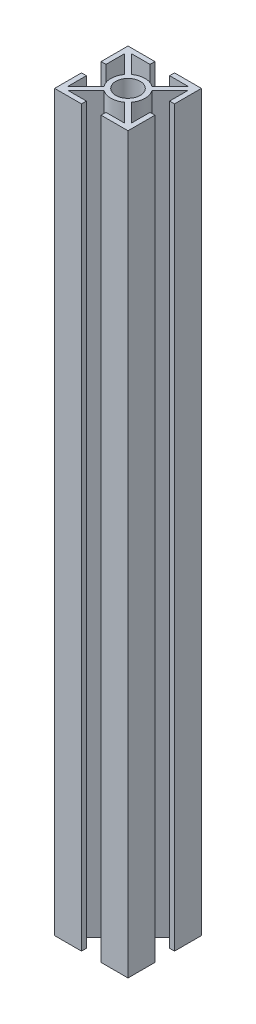
from build123d import *

# Parameters (mm, degrees)
SKETCH1_R           = 5
BOSS_EXTRUDE1_DEPTH = 300


with BuildPart() as part:
    # Sketch1 → Boss-Extrude1 (new body)
    with BuildSketch(Plane(origin=(0, 0, 0), x_dir=(1, 0, 0), z_dir=(0, 1, 0))):
        with BuildLine():
            Line((4.191872704, 5.606086267), (11.5870568, 13.001270363))
            Line((11.5870568, 13.001270363), (4.001270363, 13.001270363))
            Line((4.001270363, 13.001270363), (4.001270363, 15.001270363))
            Line((4.001270363, 15.001270363), (15.001270363, 15.001270363))
            Line((15.001270363, 15.001270363), (15.001270363, 4.001270363))
            Line((15.001270363, 4.001270363), (13.001270363, 4.001270363))
            Line((13.001270363, 4.001270363), (13.001270363, 11.5870568))
            Line((13.001270363, 11.5870568), (5.606086267, 4.191872704))
            ThreePointArc((5.606086267, 4.191872704), (7, 0), (5.606086267, -4.191872704))
            Line((5.606086267, -4.191872704), (13.001270363, -11.5870568))
            Line((13.001270363, -11.5870568), (13.001270363, -4.001270363))
            Line((13.001270363, -4.001270363), (15.001270363, -4.001270363))
            Line((15.001270363, -4.001270363), (15.001270363, -15.001270363))
            Line((15.001270363, -15.001270363), (4.001270363, -15.001270363))
            Line((4.001270363, -15.001270363), (4.001270363, -13.001270363))
            Line((4.001270363, -13.001270363), (11.5870568, -13.001270363))
            Line((11.5870568, -13.001270363), (4.191872704, -5.606086267))
            ThreePointArc((4.191872704, -5.606086267), (0, -7), (-4.191872704, -5.606086267))
            Line((-4.191872704, -5.606086267), (-11.5870568, -13.001270363))
            Line((-11.5870568, -13.001270363), (-4.001270363, -13.001270363))
            Line((-4.001270363, -13.001270363), (-4.001270363, -15.001270363))
            Line((-4.001270363, -15.001270363), (-15.001270363, -15.001270363))
            Line((-15.001270363, -15.001270363), (-15.001270363, -4.001270363))
            Line((-15.001270363, -4.001270363), (-13.001270363, -4.001270363))
            Line((-13.001270363, -4.001270363), (-13.001270363, -11.5870568))
            Line((-13.001270363, -11.5870568), (-5.606086267, -4.191872704))
            ThreePointArc((-5.606086267, -4.191872704), (-7, 0), (-5.606086267, 4.191872704))
            Line((-5.606086267, 4.191872704), (-13.001270363, 11.5870568))
            Line((-13.001270363, 11.5870568), (-13.001270363, 4.001270363))
            Line((-13.001270363, 4.001270363), (-15.001270363, 4.001270363))
            Line((-15.001270363, 4.001270363), (-15.001270363, 15.001270363))
            Line((-15.001270363, 15.001270363), (-4.001270363, 15.001270363))
            Line((-4.001270363, 15.001270363), (-4.001270363, 13.001270363))
            Line((-4.001270363, 13.001270363), (-11.5870568, 13.001270363))
            Line((-11.5870568, 13.001270363), (-4.191872704, 5.606086267))
            ThreePointArc((-4.191872704, 5.606086267), (0, 7), (4.191872704, 5.606086267))
        make_face()
        with Locations(Location((0, 0, 0), (0, 0, 270))):
            Circle(SKETCH1_R, mode=Mode.SUBTRACT)
    extrude(amount=BOSS_EXTRUDE1_DEPTH)


solid = part.part
